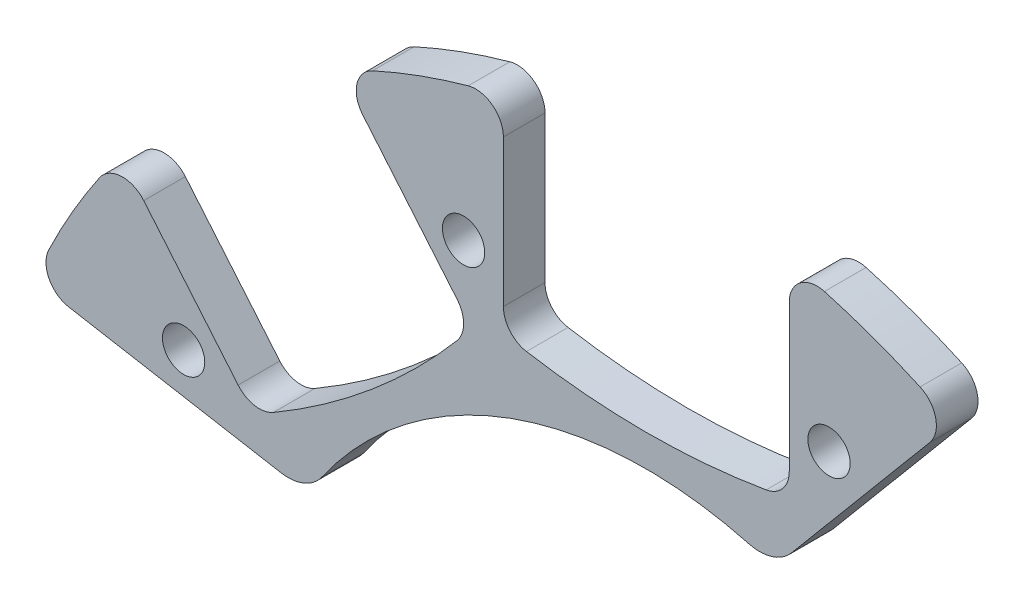
from build123d import *

# Parameters (mm, degrees)
SKETCH_1_R          = 47.75
EXTRUDE_1_DEPTH     = 3
CUT_EXTRUDE_1_DEPTH = 68.595303091
FILLET_2_R          = 2
SKETCH_3_R          = 1.525
CUT_EXTRUDE_2_DEPTH = 68.441458022
SKETCH_6_R          = 28.5
CUT_EXTRUDE_4_DEPTH = 68.441458022
SKETCH_9_W          = 2.6
SKETCH_9_H          = 3.05
EXTRUDE_3_DEPTH     = 3
CUT_EXTRUDE_6_DEPTH = 68.441458022
FILLET_4_R          = 3


with BuildPart() as part:
    # ｽｹｯﾁ1 → ﾎﾞｽ - 押し出し1 (new body)
    with BuildSketch(Plane.XY):
        Circle(SKETCH_1_R)
    extrude(amount=EXTRUDE_1_DEPTH)

    # ｽｹｯﾁ2 → ｶｯﾄ - 押し出し1 (cut, through all)
    with BuildSketch(Plane.XY.offset(3)):
        with BuildLine():
            Line((-10.3, 46.625878008), (-10.3, 42.705))
            Line((-10.3, 42.705), (-12.9, 42.705))
            Line((-12.9, 42.705), (-12.9, 39.655))
            Line((-12.9, 39.655), (-10.3, 39.655))
            Line((-10.3, 39.655), (-10.3, 31.825692416))
            ThreePointArc((-10.3, 31.825692416), (0, 30.78), (10.3, 31.825692416))
            Line((10.3, 31.825692416), (10.3, 39.655))
            Line((10.3, 39.655), (12.9, 39.655))
            Line((12.9, 39.655), (12.9, 42.705))
            Line((12.9, 42.705), (10.3, 42.705))
            Line((10.3, 42.705), (10.3, 46.625878008))
            ThreePointArc((10.3, 46.625878008), (0, 47.75), (-10.3, 46.625878008))
        make_face()
        with BuildLine():
            Line((17.599484898, 36.998204772), (12.566902991, 31.000607203))
            ThreePointArc((12.566902991, 31.000607203), (19.785002626, 23.578847959), (28.347418519, 17.759182444))
            Line((28.347418519, 17.759182444), (33.380000426, 23.756780012))
            Line((33.380000426, 23.756780012), (35.371715978, 22.085532227))
            Line((35.371715978, 22.085532227), (37.332218188, 24.421967778))
            Line((37.332218188, 24.421967778), (35.340502636, 26.093215564))
            Line((35.340502636, 26.093215564), (37.860794438, 29.096782374))
            ThreePointArc((37.860794438, 29.096782374), (30.693108363, 36.578622159), (22.08027891, 42.338207133))
            Line((22.08027891, 42.338207133), (19.559987108, 39.334640323))
            Line((19.559987108, 39.334640323), (17.568271555, 41.005888108))
            Line((17.568271555, 41.005888108), (15.607769346, 38.669452557))
            Line((15.607769346, 38.669452557), (17.599484898, 36.998204772))
        make_face()
        with BuildLine():
            Line((37.263975216, 17.029538341), (29.553612406, 15.669993347))
            ThreePointArc((29.553612406, 15.669993347), (30.312382638, 5.344890909), (33.130764866, -4.617046365))
            Line((33.130764866, -4.617046365), (40.841127676, -3.257501371))
            Line((40.841127676, -3.257501371), (41.292612938, -5.818001528))
            Line((41.292612938, -5.818001528), (44.296276584, -5.288374587))
            Line((44.296276584, -5.288374587), (43.844791322, -2.727874429))
            Line((43.844791322, -2.727874429), (47.706102383, -2.047021108))
            ThreePointArc((47.706102383, -2.047021108), (47.024570206, 8.291700484), (44.128949923, 18.240018604))
            Line((44.128949923, 18.240018604), (40.267638862, 17.559165283))
            Line((40.267638862, 17.559165283), (39.8161536, 20.119665441))
            Line((39.8161536, 20.119665441), (36.812489954, 19.590038499))
            Line((36.812489954, 19.590038499), (37.263975216, 17.029538341))
        make_face()
        with BuildLine():
            Line((39.492237387, -10.907438341), (32.711858125, -6.992784549))
            ThreePointArc((32.711858125, -6.992784549), (26.656261928, -15.39), (22.411858125, -24.832907867))
            Line((22.411858125, -24.832907867), (29.192237387, -28.747561659))
            Line((29.192237387, -28.747561659), (27.892237387, -30.999227709))
            Line((27.892237387, -30.999227709), (30.533614869, -32.524227709))
            Line((30.533614869, -32.524227709), (31.833614869, -30.272561659))
            Line((31.833614869, -30.272561659), (35.229194829, -32.233000663))
            ThreePointArc((35.229194829, -32.233000663), (41.352713031, -23.875), (45.529194829, -14.392877345))
            Line((45.529194829, -14.392877345), (42.133614869, -12.432438341))
            Line((42.133614869, -12.432438341), (43.433614869, -10.180772291))
            Line((43.433614869, -10.180772291), (40.792237387, -8.655772291))
            Line((40.792237387, -8.655772291), (39.492237387, -10.907438341))
        make_face()
        with BuildLine():
            Line((23.241642778, -33.740703401), (20.563861876, -26.383560838))
            ThreePointArc((20.563861876, -26.383560838), (10.527380012, -28.923738868), (1.206193887, -33.429175791))
            Line((1.206193887, -33.429175791), (3.883974789, -40.786318354))
            Line((3.883974789, -40.786318354), (1.440773975, -41.675570726))
            Line((1.440773975, -41.675570726), (2.483935413, -44.54163322))
            Line((2.483935413, -44.54163322), (4.927136227, -43.652380847))
            Line((4.927136227, -43.652380847), (6.268155485, -47.336800978))
            ThreePointArc((6.268155485, -47.336800978), (16.331461844, -44.870322643), (25.625823473, -40.291186025))
            Line((25.625823473, -40.291186025), (24.284804215, -36.606765894))
            Line((24.284804215, -36.606765894), (26.728005029, -35.717513522))
            Line((26.728005029, -35.717513522), (25.684843592, -32.851451028))
            Line((25.684843592, -32.851451028), (23.241642778, -33.740703401))
        make_face()
        with BuildLine():
            Line((-3.883974789, -40.786318354), (-1.206193887, -33.429175791))
            ThreePointArc((-1.206193887, -33.429175791), (-10.527380012, -28.923738868), (-20.563861876, -26.383560838))
            Line((-20.563861876, -26.383560838), (-23.241642778, -33.740703401))
            Line((-23.241642778, -33.740703401), (-25.684843592, -32.851451028))
            Line((-25.684843592, -32.851451028), (-26.728005029, -35.717513522))
            Line((-26.728005029, -35.717513522), (-24.284804215, -36.606765894))
            Line((-24.284804215, -36.606765894), (-25.625823473, -40.291186025))
            ThreePointArc((-25.625823473, -40.291186025), (-16.331461844, -44.870322643), (-6.268155485, -47.336800978))
            Line((-6.268155485, -47.336800978), (-4.927136227, -43.652380847))
            Line((-4.927136227, -43.652380847), (-2.483935413, -44.54163322))
            Line((-2.483935413, -44.54163322), (-1.440773975, -41.675570726))
            Line((-1.440773975, -41.675570726), (-3.883974789, -40.786318354))
        make_face()
        with BuildLine():
            Line((-29.192237387, -28.747561659), (-22.411858125, -24.832907867))
            ThreePointArc((-22.411858125, -24.832907867), (-26.656261928, -15.39), (-32.711858125, -6.992784549))
            Line((-32.711858125, -6.992784549), (-39.492237387, -10.907438341))
            Line((-39.492237387, -10.907438341), (-40.792237387, -8.655772291))
            Line((-40.792237387, -8.655772291), (-43.433614869, -10.180772291))
            Line((-43.433614869, -10.180772291), (-42.133614869, -12.432438341))
            Line((-42.133614869, -12.432438341), (-45.529194829, -14.392877345))
            ThreePointArc((-45.529194829, -14.392877345), (-41.352713031, -23.875), (-35.229194829, -32.233000663))
            Line((-35.229194829, -32.233000663), (-31.833614869, -30.272561659))
            Line((-31.833614869, -30.272561659), (-30.533614869, -32.524227709))
            Line((-30.533614869, -32.524227709), (-27.892237387, -30.999227709))
            Line((-27.892237387, -30.999227709), (-29.192237387, -28.747561659))
        make_face()
        with BuildLine():
            Line((-40.841127676, -3.257501371), (-33.130764866, -4.617046365))
            ThreePointArc((-33.130764866, -4.617046365), (-30.312382638, 5.344890909), (-29.553612406, 15.669993347))
            Line((-29.553612406, 15.669993347), (-37.263975216, 17.029538341))
            Line((-37.263975216, 17.029538341), (-36.812489954, 19.590038499))
            Line((-36.812489954, 19.590038499), (-39.8161536, 20.119665441))
            Line((-39.8161536, 20.119665441), (-40.267638862, 17.559165283))
            Line((-40.267638862, 17.559165283), (-44.128949923, 18.240018604))
            ThreePointArc((-44.128949923, 18.240018604), (-47.024570206, 8.291700484), (-47.706102383, -2.047021108))
            Line((-47.706102383, -2.047021108), (-43.844791322, -2.727874429))
            Line((-43.844791322, -2.727874429), (-44.296276584, -5.288374587))
            Line((-44.296276584, -5.288374587), (-41.292612938, -5.818001528))
            Line((-41.292612938, -5.818001528), (-40.841127676, -3.257501371))
        make_face()
        with BuildLine():
            Line((-33.380000426, 23.756780012), (-28.347418519, 17.759182444))
            ThreePointArc((-28.347418519, 17.759182444), (-19.785002626, 23.578847959), (-12.566902991, 31.000607203))
            Line((-12.566902991, 31.000607203), (-17.599484898, 36.998204772))
            Line((-17.599484898, 36.998204772), (-15.607769346, 38.669452557))
            Line((-15.607769346, 38.669452557), (-17.568271555, 41.005888108))
            Line((-17.568271555, 41.005888108), (-19.559987108, 39.334640323))
            Line((-19.559987108, 39.334640323), (-22.08027891, 42.338207133))
            ThreePointArc((-22.08027891, 42.338207133), (-30.693108363, 36.578622159), (-37.860794438, 29.096782374))
            Line((-37.860794438, 29.096782374), (-35.340502636, 26.093215564))
            Line((-35.340502636, 26.093215564), (-37.332218188, 24.421967778))
            Line((-37.332218188, 24.421967778), (-35.371715978, 22.085532227))
            Line((-35.371715978, 22.085532227), (-33.380000426, 23.756780012))
        make_face()
    extrude(amount=-CUT_EXTRUDE_1_DEPTH, mode=Mode.SUBTRACT)

    # ﾌｨﾚｯﾄ2
    fillet_2_edges = [part.edges().sort_by_distance(p)[0] for p in [
        (-47.706102383, -2.047021108, 1.5),
        (-44.128949923, 18.240018604, 1.5),
        (-29.553612406, 15.669993347, 1.5),
        (-33.130764866, -4.617046365, 1.5),
        (-37.860794438, 29.096782374, 1.5),
        (-22.08027891, 42.338207133, 1.5),
        (-12.566902991, 31.000607203, 1.5),
        (-28.347418519, 17.759182444, 1.5),
        (-6.268155485, -47.336800978, 1.5),
        (-25.625823473, -40.291186025, 1.5),
        (-20.563861876, -26.383560838, 1.5),
        (-1.206193887, -33.429175791, 1.5),
        (-35.229194829, -32.233000663, 1.5),
        (-45.529194829, -14.392877345, 1.5),
        (-32.711858125, -6.992784549, 1.5),
        (-22.411858125, -24.832907867, 1.5),
        (45.529194829, -14.392877345, 1.5),
        (35.229194829, -32.233000663, 1.5),
        (22.411858125, -24.832907867, 1.5),
        (32.711858125, -6.992784549, 1.5),
        (25.625823473, -40.291186025, 1.5),
        (6.268155485, -47.336800978, 1.5),
        (1.206193887, -33.429175791, 1.5),
        (20.563861876, -26.383560838, 1.5),
        (22.08027891, 42.338207133, 1.5),
        (37.860794438, 29.096782374, 1.5),
        (28.347418519, 17.759182444, 1.5),
        (12.566902991, 31.000607203, 1.5),
        (44.128949923, 18.240018604, 1.5),
        (47.706102383, -2.047021108, 1.5),
        (33.130764866, -4.617046365, 1.5),
        (29.553612406, 15.669993347, 1.5),
        (-10.3, 46.625878008, 1.5),
        (10.3, 46.625878008, 1.5),
        (10.3, 31.825692416, 1.5),
        (-10.3, 31.825692416, 1.5),
    ]]
    fillet(fillet_2_edges, radius=FILLET_2_R)

    # ｽｹｯﾁ3 → ｶｯﾄ - 押し出し2 (cut, through all)
    with BuildSketch(Plane.XY.offset(3)):
        with Locations((0, -38.5)):
            Circle(SKETCH_3_R)
        with Locations((-24.747322973, -29.49271106)):
            Circle(SKETCH_3_R)
        with Locations((-37.915098491, -6.68545484)):
            Circle(SKETCH_3_R)
        with Locations((-33.341978046, 19.25)):
            Circle(SKETCH_3_R)
        with Locations((-13.167775518, 36.1781659)):
            Circle(SKETCH_3_R)
        with Locations((13.167775518, 36.1781659)):
            Circle(SKETCH_3_R)
        with Locations((33.341978046, 19.25)):
            Circle(SKETCH_3_R)
        with Locations((37.915098491, -6.68545484)):
            Circle(SKETCH_3_R)
        with Locations((24.747322973, -29.49271106)):
            Circle(SKETCH_3_R)
    extrude(amount=-CUT_EXTRUDE_2_DEPTH, mode=Mode.SUBTRACT)

    # ｽｹｯﾁ6 → ｶｯﾄ - 押し出し4 (cut, through all)
    with BuildSketch(Plane(origin=(0, 0, 0), x_dir=(-1, 0, 0), z_dir=(0, 0, -1))):
        Circle(SKETCH_6_R)
    extrude(amount=-CUT_EXTRUDE_4_DEPTH, mode=Mode.SUBTRACT)

    # ｽｹｯﾁ9 → ﾎﾞｽ - 押し出し3 (add)
    with BuildSketch(Plane(origin=(0, 0, 0), x_dir=(-1, 0, 0), z_dir=(0, 0, -1))):
        Polygon((-19.559987108, 39.334640323), (-17.599484898, 36.998204772), (-15.607769346, 38.669452557), (-17.568271555, 41.005888108), align=None)
        with Locations((-11.6, 41.18)):
            Rectangle(SKETCH_9_W, SKETCH_9_H)
        with Locations((11.6, 41.18)):
            Rectangle(SKETCH_9_W, SKETCH_9_H)
        Polygon((17.599484898, 36.998204772), (15.607769346, 38.669452557), (17.568271555, 41.005888108), (19.559987108, 39.334640323), align=None)
        Polygon((33.380000426, 23.756780012), (35.371715978, 22.085532227), (37.332218188, 24.421967778), (35.340502636, 26.093215564), align=None)
        Polygon((36.812489954, 19.590038499), (37.263975216, 17.029538341), (40.267638862, 17.559165283), (39.8161536, 20.119665441), align=None)
    extrude(amount=-EXTRUDE_3_DEPTH)

    # ｽｹｯﾁ10 → ｶｯﾄ - 押し出し6 (cut, through all)
    with BuildSketch(Plane(origin=(0, 0, 0), x_dir=(-1, 0, 0), z_dir=(0, 0, -1))):
        with BuildLine():
            Line((-22.902623398, 43.318239132), (4.067787689, 11.176154824))
            Line((4.067787689, 11.176154824), (45.388854775, 18.462173823))
            ThreePointArc((45.388854775, 18.462173823), (-16.758987023, -46.044938419), (-22.902623398, 43.318239132))
        make_face()
    extrude(amount=-CUT_EXTRUDE_6_DEPTH, mode=Mode.SUBTRACT)

    # ﾌｨﾚｯﾄ4
    fillet_4_edges = [part.edges().sort_by_distance(p)[0] for p in [
        (-24.381381174, 14.75798943, 1.5),
        (9.190968814, 26.977325521, 1.5),
    ]]
    fillet(fillet_4_edges, radius=FILLET_4_R)


solid = part.part
